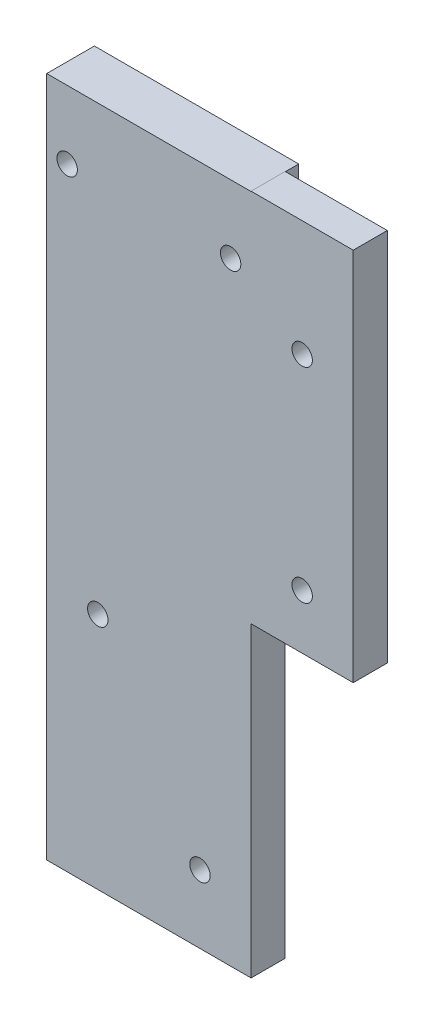
from build123d import *

# Parameters (mm, degrees)
SALIENTE_EXTRUIR1_START = 2
SALIENTE_EXTRUIR1_DEPTH = 5
CROQUIS2_W              = 30
CROQUIS2_H              = 25
SALIENTE_EXTRUIR2_DEPTH = 2
CROQUIS3_R              = 1.5
CORTAR_EXTRUIR1_DEPTH   = 10
CROQUIS4_R              = 1.500036904
CROQUIS4_R_2            = 1.5
CORTAR_EXTRUIR2_DEPTH   = 10
CROQUIS6_W              = 5
CROQUIS6_H              = 55
SALIENTE_EXTRUIR3_DEPTH = 15
CROQUIS7_R              = 1.5
CORTAR_EXTRUIR3_DEPTH   = 20


with BuildPart() as part:
    # Croquis1 → Saliente-Extruir1 (new body)
    with BuildSketch(Plane.XY.offset(SALIENTE_EXTRUIR1_START)):
        Polygon((65.454041039, -1015), (65.454041039, -1005), (95.454041039, -1005), (95.454041039, -1015), (95.454041039, -1105), (65.454041039, -1105), align=None)
    extrude(amount=SALIENTE_EXTRUIR1_DEPTH)

    # Croquis2 → Saliente-Extruir2 (add)
    with BuildSketch(Plane(origin=(0, 0, 2), x_dir=(-1, 0, 0), z_dir=(0, 0, -1))):
        with Locations((-80.454041039, -1017.5)):
            Rectangle(CROQUIS2_W, CROQUIS2_H)
    extrude(amount=SALIENTE_EXTRUIR2_DEPTH)

    # Croquis3 → Cortar-Extruir1 (cut)
    with BuildSketch(Plane(origin=(0, 0, 2), x_dir=(-1, 0, 0), z_dir=(0, 0, -1))):
        with Locations((-72.954041039, -1070)):
            Circle(CROQUIS3_R)
        with Locations((-87.954041039, -1095)):
            Circle(CROQUIS3_R)
    extrude(amount=-CORTAR_EXTRUIR1_DEPTH, mode=Mode.SUBTRACT)

    # Croquis4 → Cortar-Extruir2 (cut)
    with BuildSketch(Plane(origin=(0, 0, 0), x_dir=(-1, 0, 0), z_dir=(0, 0, -1))):
        with Locations((-92.454041038, -1014.999963096)):
            Circle(CROQUIS4_R)
        with Locations((-68.454041039, -1015)):
            Circle(CROQUIS4_R_2)
    extrude(amount=-CORTAR_EXTRUIR2_DEPTH, mode=Mode.SUBTRACT)

    # Croquis6 → Saliente-Extruir3 (add)
    with BuildSketch(Plane(origin=(95.454041039, 0, 0), x_dir=(0, 0, -1), z_dir=(1, 0, 0))):
        with Locations((-4.5, -1032.456092312)):
            Rectangle(CROQUIS6_W, CROQUIS6_H)
    extrude(amount=SALIENTE_EXTRUIR3_DEPTH)

    # Croquis7 → Cortar-Extruir3 (cut)
    with BuildSketch(Plane.XY.offset(7)):
        with Locations((102.954041039, -1051.956092312)):
            Circle(CROQUIS7_R)
        with Locations((102.954041039, -1021.956092312)):
            Circle(CROQUIS7_R)
    extrude(amount=-CORTAR_EXTRUIR3_DEPTH, mode=Mode.SUBTRACT)


solid = part.part
